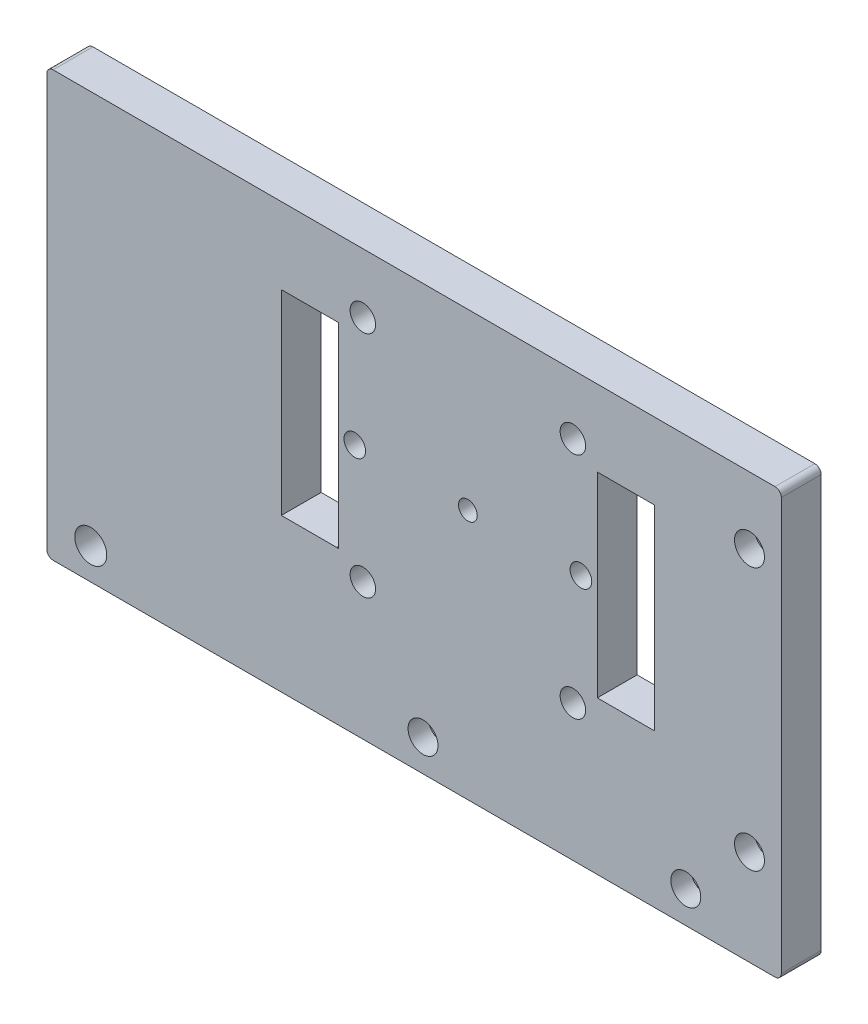
from build123d import *

# Parameters (mm, degrees)
SKETCH5_W               = 91.75
SKETCH5_H               = 67.75
SKETCH5_R               = 2.3876
SKETCH5_R_2             = 3.683
SKETCH5_R_3             = 1.5
SKETCH5_W_2             = 8.85
SKETCH5_H_2             = 31.2
SKETCH5_R_4             = 1.5875
BOSS_EXTRUDE1_DEPTH     = 6.35
F_8_32_TAPPED_HOLE1_D   = 3.4544
CUT_EXTRUDE2_START      = 3.175
SKETCH5_3_R             = 2.3876
SKETCH5_3_R_2           = 1.5875
CUT_EXTRUDE2_DEPTH      = 3.175
SKETCH8_W               = 25.4
SKETCH8_H               = 67.75
SKETCH8_R               = 1
BOSS_EXTRUDE2_DEPTH     = 6.35
F_1_4_20_TAPPED_HOLE2_D = 5.1054
CUT_EXTRUDE3_DEPTH      = 140.2958778
CUT_EXTRUDE3_DEPTH_BACK = 140.2958778
SKETCH11_R              = 2.032
CUT_EXTRUDE4_DEPTH      = 140.2958778
CUT_EXTRUDE4_DEPTH_BACK = 140.2958778
SKETCH12_W              = 0.25
SKETCH12_H              = 31.2
SKETCH12_H_2            = 31.222616973
FILLET2_R               = 1


with BuildPart() as part:
    # Sketch5 → Boss-Extrude1 (new body)
    # profile 1 of 6: a face of its own
    with BuildSketch(Plane.XY):
        with Locations((-48.669, 36.669)):
            Rectangle(SKETCH5_W, SKETCH5_H)
        with Locations((-7.874, 18.034)):
            Circle(SKETCH5_R, mode=Mode.SUBTRACT)
        with Locations((-7.874, 59.944)):
            Circle(SKETCH5_R, mode=Mode.SUBTRACT)
        with Locations((-18.034, 7.874)):
            Circle(SKETCH5_R, mode=Mode.SUBTRACT)
        with Locations((-59.944, 7.874)):
            Circle(SKETCH5_R, mode=Mode.SUBTRACT)
        with Locations((-19.9136, 19.9136)):
            Circle(SKETCH5_R_2, mode=Mode.SUBTRACT)
        with Locations((-52.794, 42.794)):
            Circle(SKETCH5_R_3, mode=Mode.SUBTRACT)
        with Locations((-78.119, 42.794)):
            Rectangle(SKETCH5_W_2, SKETCH5_H_2, mode=Mode.SUBTRACT)
        with Locations((-27.469, 42.794)):
            Rectangle(SKETCH5_W_2, SKETCH5_H_2, mode=Mode.SUBTRACT)
    # profile 2 of 6: a face of its own
    with BuildSketch(Plane.XY):
        with Locations((-7.874, 59.944)):
            Circle(SKETCH5_R)
        with Locations((-7.874, 59.944)):
            Circle(SKETCH5_R_4, mode=Mode.SUBTRACT)
    # profile 3 of 6: a face of its own
    with BuildSketch(Plane.XY):
        with Locations((-19.9136, 19.9136)):
            Circle(SKETCH5_R_2)
    # profile 4 of 6: a face of its own
    with BuildSketch(Plane.XY):
        with Locations((-7.874, 18.034)):
            Circle(SKETCH5_R)
        with Locations((-7.874, 18.034)):
            Circle(SKETCH5_R_4, mode=Mode.SUBTRACT)
    # profile 5 of 6: a face of its own
    with BuildSketch(Plane.XY):
        with Locations((-18.034, 7.874)):
            Circle(SKETCH5_R)
        with Locations((-18.034, 7.874)):
            Circle(SKETCH5_R_4, mode=Mode.SUBTRACT)
    # profile 6 of 6: a face of its own
    with BuildSketch(Plane.XY):
        with Locations((-59.944, 7.874)):
            Circle(SKETCH5_R)
        with Locations((-59.944, 7.874)):
            Circle(SKETCH5_R_4, mode=Mode.SUBTRACT)
    extrude(amount=BOSS_EXTRUDE1_DEPTH)

    # #8-32 Tapped Hole1 (through all)
    with Locations(Plane(origin=(-70.828, 42.794, 6.35), x_dir=(1, 0, 0), z_dir=(0, 0, 1))):
        with Locations((0, 0), (36.068, 0)):
            Hole(F_8_32_TAPPED_HOLE1_D / 2)

    # Sketch5<3> → Cut-Extrude2 (cut)
    # profile 1 of 4: a face of its own
    with BuildSketch(Plane.XY.offset(CUT_EXTRUDE2_START)):
        with Locations((-18.034, 7.874)):
            Circle(SKETCH5_3_R)
        with Locations((-18.034, 7.874)):
            Circle(SKETCH5_3_R_2, mode=Mode.SUBTRACT)
    # profile 2 of 4: a face of its own
    with BuildSketch(Plane.XY.offset(CUT_EXTRUDE2_START)):
        with Locations((-7.874, 18.034)):
            Circle(SKETCH5_3_R)
        with Locations((-7.874, 18.034)):
            Circle(SKETCH5_3_R_2, mode=Mode.SUBTRACT)
    # profile 3 of 4: a face of its own
    with BuildSketch(Plane.XY.offset(CUT_EXTRUDE2_START)):
        with Locations((-59.944, 7.874)):
            Circle(SKETCH5_3_R)
        with Locations((-59.944, 7.874)):
            Circle(SKETCH5_3_R_2, mode=Mode.SUBTRACT)
    # profile 4 of 4: a face of its own
    with BuildSketch(Plane.XY.offset(CUT_EXTRUDE2_START)):
        with Locations((-7.874, 59.944)):
            Circle(SKETCH5_3_R)
        with Locations((-7.874, 59.944)):
            Circle(SKETCH5_3_R_2, mode=Mode.SUBTRACT)
    extrude(amount=CUT_EXTRUDE2_DEPTH, mode=Mode.SUBTRACT)

    # Sketch8 → Boss-Extrude2 (add)
    with BuildSketch(Plane.XY):
        with Locations((-107.244, 36.669)):
            Rectangle(SKETCH8_W, SKETCH8_H)
        with Locations((-112.944, 7.794)):
            Circle(SKETCH8_R, mode=Mode.SUBTRACT)
    extrude(amount=BOSS_EXTRUDE2_DEPTH)

    # 1/4-20 Tapped Hole2 (through all)
    with Locations(Plane(origin=(-112.944, 7.794, 6.35), x_dir=(1, 0, 0), z_dir=(0, 0, 1))):
        with Locations((0, 0)):
            Hole(F_1_4_20_TAPPED_HOLE2_D / 2)

    # Sketch11 → Cut-Extrude3 (cut, two sides: drawn at the far end of the back side and taken through both)
    with BuildSketch(Plane.XY.offset(6.35).offset(-CUT_EXTRUDE3_DEPTH_BACK)):
        with Locations((-69.544, 61.044)):
            Circle(SKETCH11_R)
        with Locations((-36.044, 61.044)):
            Circle(SKETCH11_R)
        with Locations((-36.044, 24.544)):
            Circle(SKETCH11_R)
        with Locations((-69.544, 24.544)):
            Circle(SKETCH11_R)
    extrude(amount=CUT_EXTRUDE3_DEPTH + CUT_EXTRUDE3_DEPTH_BACK, mode=Mode.SUBTRACT)

    # Sketch12 → Cut-Extrude4 (cut, two sides: drawn at the far end of the back side and taken through both)
    with BuildSketch(Plane.XY.offset(6.35).offset(-CUT_EXTRUDE4_DEPTH_BACK)):
        with Locations((-32.019, 42.794)):
            Rectangle(SKETCH12_W, SKETCH12_H)
        with Locations((-73.569, 42.782691514)):
            Rectangle(SKETCH12_W, SKETCH12_H_2)
    extrude(amount=CUT_EXTRUDE4_DEPTH + CUT_EXTRUDE4_DEPTH_BACK, mode=Mode.SUBTRACT)

    # Fillet2
    fillet2_edges = [part.edges().sort_by_distance(p)[0] for p in [
        (-119.944, 70.544, 3.175),
        (-2.794, 2.794, 3.175),
        (-2.794, 70.544, 3.175),
        (-119.944, 2.794, 3.175),
    ]]
    fillet(fillet2_edges, radius=FILLET2_R)


solid = part.part
